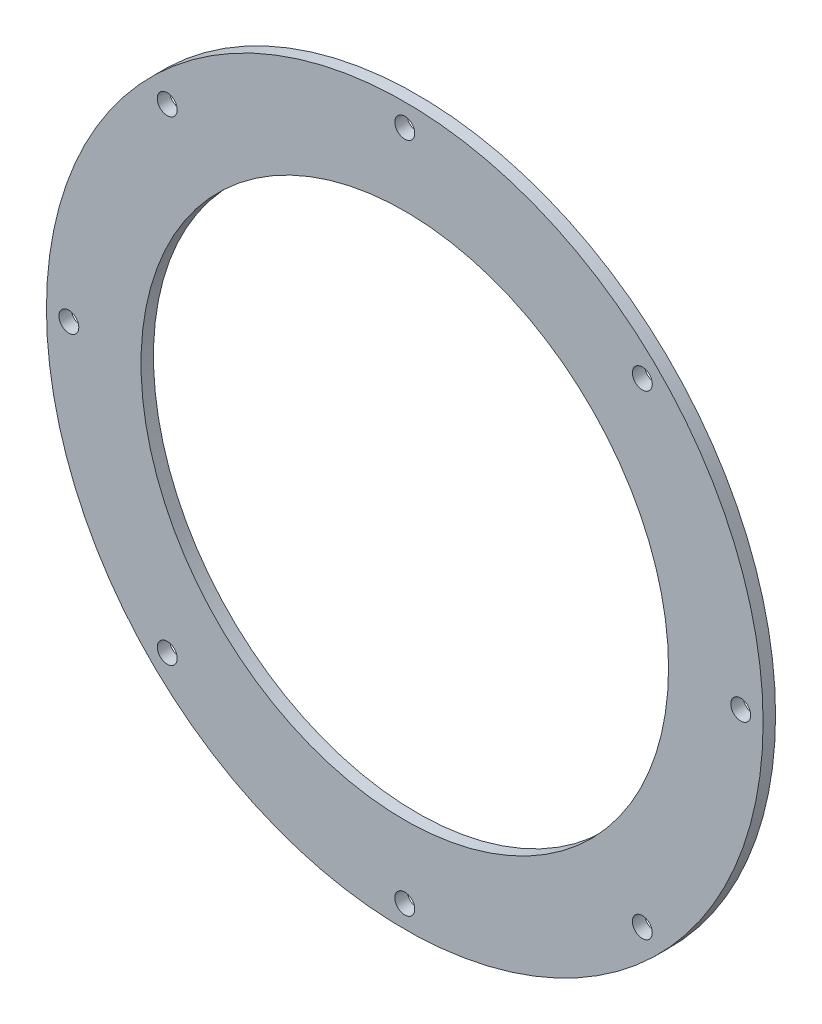
from build123d import *

# Parameters (mm, degrees)
SKETCH_1_R      = 72
SKETCH_1_R_2    = 2
SKETCH_1_R_3    = 53
EXTRUDE_1_DEPTH = 2.5


with BuildPart() as part:
    # 草图1 → 凸台-拉伸1 (new body)
    with BuildSketch(Plane.XY):
        Circle(SKETCH_1_R)
        with Locations((0, -67.5)):
            Circle(SKETCH_1_R_2, mode=Mode.SUBTRACT)
        with Locations((-47.72970773, -47.72970773)):
            Circle(SKETCH_1_R_2, mode=Mode.SUBTRACT)
        with Locations((-67.5, 0)):
            Circle(SKETCH_1_R_2, mode=Mode.SUBTRACT)
        with Locations((-47.72970773, 47.72970773)):
            Circle(SKETCH_1_R_2, mode=Mode.SUBTRACT)
        with Locations((0, 67.5)):
            Circle(SKETCH_1_R_2, mode=Mode.SUBTRACT)
        with Locations((47.72970773, 47.72970773)):
            Circle(SKETCH_1_R_2, mode=Mode.SUBTRACT)
        with Locations((67.5, 0)):
            Circle(SKETCH_1_R_2, mode=Mode.SUBTRACT)
        with Locations((47.72970773, -47.72970773)):
            Circle(SKETCH_1_R_2, mode=Mode.SUBTRACT)
        Circle(SKETCH_1_R_3, mode=Mode.SUBTRACT)
    extrude(amount=EXTRUDE_1_DEPTH)


solid = part.part
